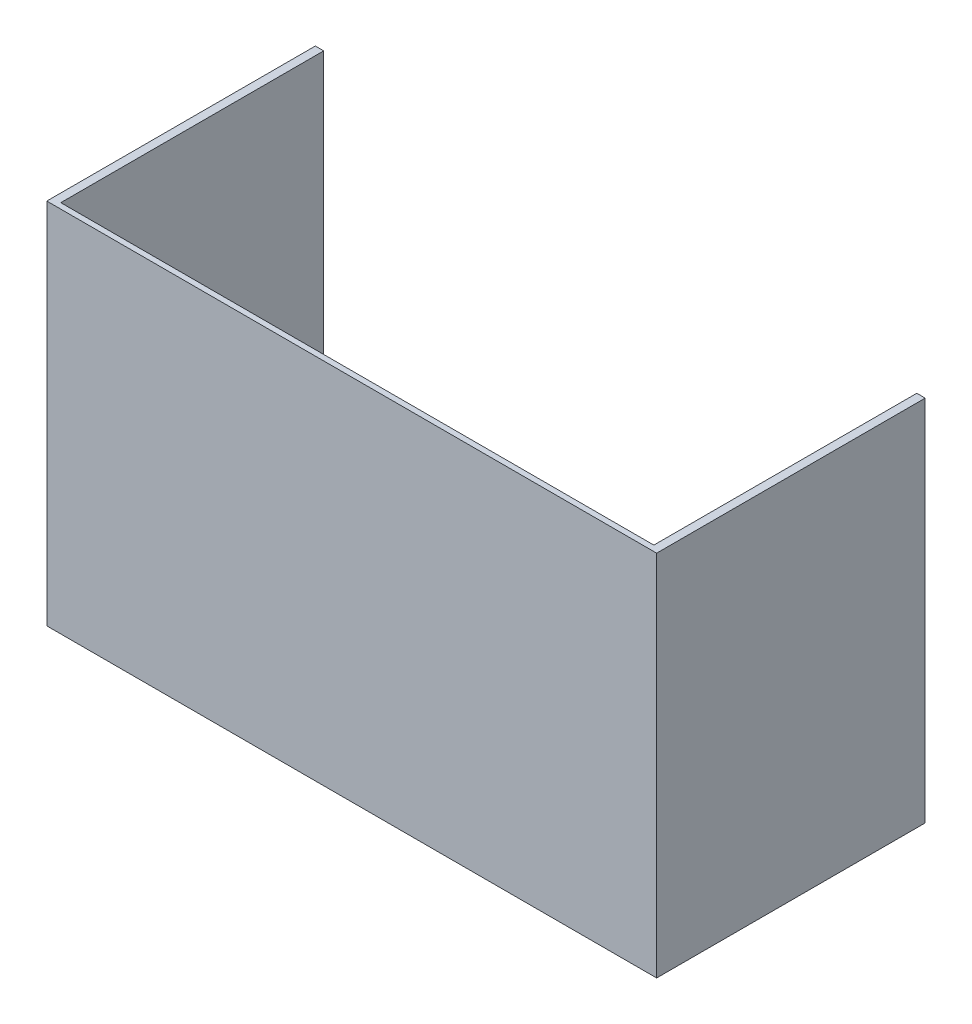
from build123d import *

# Parameters (mm, degrees)
SKETCH1_W           = 692.15
SKETCH1_H           = 417.576
BOSS_EXTRUDE1_DEPTH = 304.8
SKETCH2_W           = 673.1
SKETCH2_H           = 417.576
CUT_EXTRUDE1_DEPTH  = 298.45


with BuildPart() as part:
    # Sketch1 → Boss-Extrude1 (new body)
    with BuildSketch(Plane.XY):
        Rectangle(SKETCH1_W, SKETCH1_H)
    extrude(amount=BOSS_EXTRUDE1_DEPTH)

    # Sketch2 → Cut-Extrude1 (cut)
    with BuildSketch(Plane(origin=(0, 0, 0), x_dir=(-1, 0, 0), z_dir=(0, 0, -1))):
        Rectangle(SKETCH2_W, SKETCH2_H)
    extrude(amount=-CUT_EXTRUDE1_DEPTH, mode=Mode.SUBTRACT)


solid = part.part
